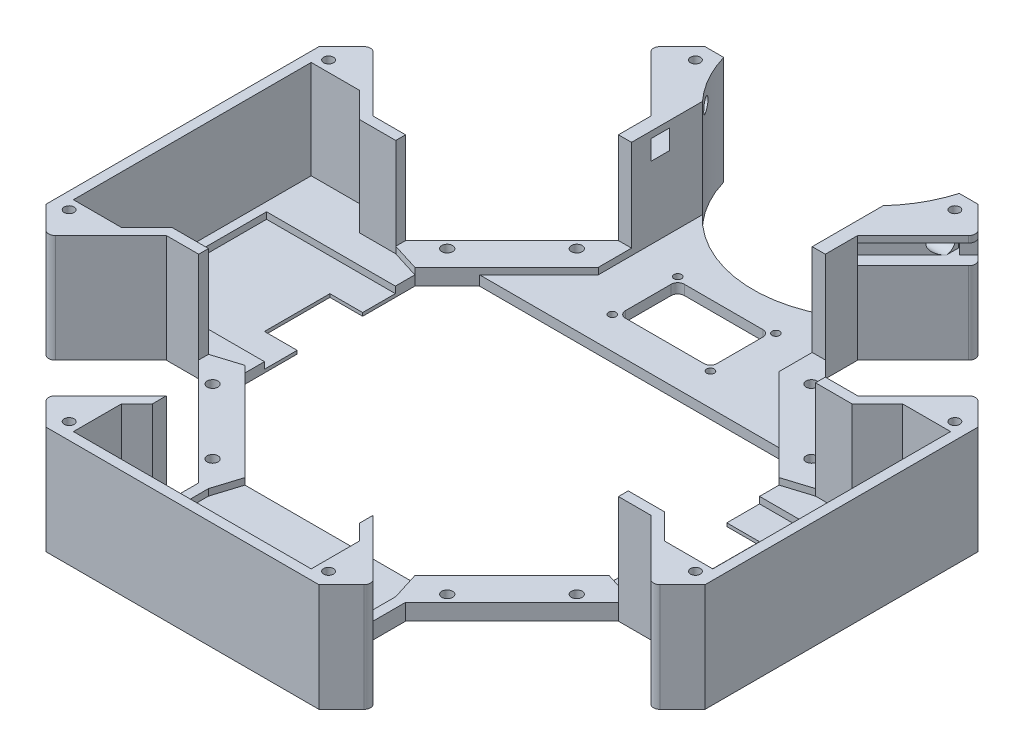
from build123d import *
from build123d.topology import SkipClean

# Parameters (mm, degrees)
BOSS_EXTRUDE1_DEPTH     = 3
CUT_EXTRUDE1_REACH      = 144.447
SKETCH2_R               = 1.65
CUT_EXTRUDE2_REACH      = 144.447
SKETCH3_R               = 37.5
CHAMFER1_SIZE           = 8
CHAMFER2_SIZE           = 7
CUT_EXTRUDE3_REACH      = 144.447
SKETCH4_R               = 1.5
CUT_EXTRUDE4_REACH      = 144.447
BOSS_EXTRUDE2_START     = 30
SKETCH7_R               = 1.5
BOSS_EXTRUDE2_DEPTH     = 30
CUT_EXTRUDE5_REACH      = 148.189
SKETCH8_W               = 20
SKETCH8_H               = 12
SKETCH10_W              = 190
SKETCH10_H              = 40
CUT_EXTRUDE6_DEPTH      = 2
BOSS_EXTRUDE4_START     = 2
SKETCH11_R              = 1.65
BOSS_EXTRUDE4_DEPTH     = 2
SKETCH12_W              = 3
SKETCH12_H              = 14.142135624
CUT_EXTRUDE7_DEPTH      = 28
CUT_EXTRUDE8_REACH      = 148.189
SKETCH13_R              = 1.15
CUT_EXTRUDE9_DEPTH      = 180.62965353
CUT_EXTRUDE9_DEPTH_BACK = 180.62965353
SKETCH14_R              = 2
SKETCH15_R              = 3
CUT_EXTRUDE10_DEPTH     = 10
SKETCH16_W              = 2
SKETCH16_H              = 6
CUT_EXTRUDE11_DEPTH     = 30
CUT_EXTRUDE12_START     = -10
SKETCH17_R              = 3
CUT_EXTRUDE12_DEPTH     = 10
SKETCH18_W              = 2
SKETCH18_H              = 6
CUT_EXTRUDE13_DEPTH     = 30
BOSS_EXTRUDE5_DEPTH     = 33
CUT_EXTRUDE15_REACH     = 247.348
SKETCH22_W              = 4
SKETCH22_H              = 6
CUT_EXTRUDE17_REACH     = 247.348
SKETCH24_W              = 4
SKETCH24_H              = 6
SKETCH25_W              = 131.3026648
SKETCH25_H              = 20
CUT_EXTRUDE18_DEPTH     = 20


with BuildPart() as part:
    # Sketch1 → Boss-Extrude1 (new body)
    with BuildSketch(Plane(origin=(0, 0, 0), x_dir=(1, 0, 0), z_dir=(0, 1, 0))):
        Polygon((-41.712494128, 100.702869044), (-100.702869044, 41.712494128), (-100.702869044, -41.712494128), (-41.712494128, -100.702869044), (41.712494128, -100.702869044), (100.702869044, -41.712494128), (100.702869044, 41.712494128), (41.712494128, 100.702869044), align=None)
    extrude(amount=BOSS_EXTRUDE1_DEPTH)

    # Sketch2 → Cut-Extrude1 (cut, up to next)
    with BuildSketch(Plane(origin=(0, 3, 0), x_dir=(1, 0, 0), z_dir=(0, 1, 0)), mode=Mode.PRIVATE) as cut_extrude1_sk1:
        with Locations(Location((-55.6513324, 35.852342526, 0), (0, 0, 270))):
            Circle(SKETCH2_R)
    cut_extrude1_tool1 = extrude(cut_extrude1_sk1.sketch, amount=-CUT_EXTRUDE1_REACH, mode=Mode.PRIVATE) & part.part
    # Sketch2 → Cut-Extrude1 (cut, up to next)
    with BuildSketch(Plane(origin=(0, 3, 0), x_dir=(1, 0, 0), z_dir=(0, 1, 0)), mode=Mode.PRIVATE) as cut_extrude1_sk2:
        with Locations(Location((-35.852342526, 55.6513324, 0), (0, 0, 270))):
            Circle(SKETCH2_R)
    cut_extrude1_tool2 = extrude(cut_extrude1_sk2.sketch, amount=-CUT_EXTRUDE1_REACH, mode=Mode.PRIVATE) & part.part
    # Sketch2 → Cut-Extrude1 (cut, up to next)
    with BuildSketch(Plane(origin=(0, 3, 0), x_dir=(1, 0, 0), z_dir=(0, 1, 0)), mode=Mode.PRIVATE) as cut_extrude1_sk3:
        with Locations(Location((55.6513324, 35.852342526, 0), (0, 0, 270))):
            Circle(SKETCH2_R)
    cut_extrude1_tool3 = extrude(cut_extrude1_sk3.sketch, amount=-CUT_EXTRUDE1_REACH, mode=Mode.PRIVATE) & part.part
    # Sketch2 → Cut-Extrude1 (cut, up to next)
    with BuildSketch(Plane(origin=(0, 3, 0), x_dir=(1, 0, 0), z_dir=(0, 1, 0)), mode=Mode.PRIVATE) as cut_extrude1_sk4:
        with Locations(Location((35.852342526, 55.6513324, 0), (0, 0, 270))):
            Circle(SKETCH2_R)
    cut_extrude1_tool4 = extrude(cut_extrude1_sk4.sketch, amount=-CUT_EXTRUDE1_REACH, mode=Mode.PRIVATE) & part.part
    # Sketch2 → Cut-Extrude1 (cut, up to next)
    with BuildSketch(Plane(origin=(0, 3, 0), x_dir=(1, 0, 0), z_dir=(0, 1, 0)), mode=Mode.PRIVATE) as cut_extrude1_sk5:
        with Locations(Location((35.852342526, -55.6513324, 0), (0, 0, 270))):
            Circle(SKETCH2_R)
    cut_extrude1_tool5 = extrude(cut_extrude1_sk5.sketch, amount=-CUT_EXTRUDE1_REACH, mode=Mode.PRIVATE) & part.part
    # Sketch2 → Cut-Extrude1 (cut, up to next)
    with BuildSketch(Plane(origin=(0, 3, 0), x_dir=(1, 0, 0), z_dir=(0, 1, 0)), mode=Mode.PRIVATE) as cut_extrude1_sk6:
        with Locations(Location((55.6513324, -35.852342526, 0), (0, 0, 270))):
            Circle(SKETCH2_R)
    cut_extrude1_tool6 = extrude(cut_extrude1_sk6.sketch, amount=-CUT_EXTRUDE1_REACH, mode=Mode.PRIVATE) & part.part
    # Sketch2 → Cut-Extrude1 (cut, up to next)
    with BuildSketch(Plane(origin=(0, 3, 0), x_dir=(1, 0, 0), z_dir=(0, 1, 0)), mode=Mode.PRIVATE) as cut_extrude1_sk7:
        with Locations(Location((-55.6513324, -35.852342526, 0), (0, 0, 270))):
            Circle(SKETCH2_R)
    cut_extrude1_tool7 = extrude(cut_extrude1_sk7.sketch, amount=-CUT_EXTRUDE1_REACH, mode=Mode.PRIVATE) & part.part
    # Sketch2 → Cut-Extrude1 (cut, up to next)
    with BuildSketch(Plane(origin=(0, 3, 0), x_dir=(1, 0, 0), z_dir=(0, 1, 0)), mode=Mode.PRIVATE) as cut_extrude1_sk8:
        with Locations(Location((-35.852342526, -55.6513324, 0), (0, 0, 270))):
            Circle(SKETCH2_R)
    cut_extrude1_tool8 = extrude(cut_extrude1_sk8.sketch, amount=-CUT_EXTRUDE1_REACH, mode=Mode.PRIVATE) & part.part
    # Sketch2 → Cut-Extrude1 (cut, up to next)
    with BuildSketch(Plane(origin=(0, 3, 0), x_dir=(1, 0, 0), z_dir=(0, 1, 0)), mode=Mode.PRIVATE) as cut_extrude1_sk9:
        Polygon((-92.420885021, 49.99447815), (-49.99447815, 92.420885021), (-26.659954371, 69.086361242), (-69.086361242, 26.659954371), align=None)
    cut_extrude1_tool9 = extrude(cut_extrude1_sk9.sketch, amount=-CUT_EXTRUDE1_REACH, mode=Mode.PRIVATE) & part.part
    # Sketch2 → Cut-Extrude1 (cut, up to next)
    with BuildSketch(Plane(origin=(0, 3, 0), x_dir=(1, 0, 0), z_dir=(0, 1, 0)), mode=Mode.PRIVATE) as cut_extrude1_sk10:
        Polygon((49.99447815, 92.420885021), (92.420885021, 49.99447815), (69.086361242, 26.659954371), (26.659954371, 69.086361242), align=None)
    cut_extrude1_tool10 = extrude(cut_extrude1_sk10.sketch, amount=-CUT_EXTRUDE1_REACH, mode=Mode.PRIVATE) & part.part
    # Sketch2 → Cut-Extrude1 (cut, up to next)
    with BuildSketch(Plane(origin=(0, 3, 0), x_dir=(1, 0, 0), z_dir=(0, 1, 0)), mode=Mode.PRIVATE) as cut_extrude1_sk11:
        Polygon((92.420885021, -49.99447815), (49.99447815, -92.420885021), (26.659954371, -69.086361242), (69.086361242, -26.659954371), align=None)
    cut_extrude1_tool11 = extrude(cut_extrude1_sk11.sketch, amount=-CUT_EXTRUDE1_REACH, mode=Mode.PRIVATE) & part.part
    # Sketch2 → Cut-Extrude1 (cut, up to next)
    with BuildSketch(Plane(origin=(0, 3, 0), x_dir=(1, 0, 0), z_dir=(0, 1, 0)), mode=Mode.PRIVATE) as cut_extrude1_sk12:
        Polygon((-49.99447815, -92.420885021), (-92.420885021, -49.99447815), (-69.086361242, -26.659954371), (-26.659954371, -69.086361242), align=None)
    cut_extrude1_tool12 = extrude(cut_extrude1_sk12.sketch, amount=-CUT_EXTRUDE1_REACH, mode=Mode.PRIVATE) & part.part
    add(cut_extrude1_tool1.solids().sort_by_distance((-55.651332, 3, -35.852343))[0], mode=Mode.SUBTRACT)
    add(cut_extrude1_tool2.solids().sort_by_distance((-35.852343, 3, -55.651332))[0], mode=Mode.SUBTRACT)
    add(cut_extrude1_tool3.solids().sort_by_distance((55.651332, 3, -35.852343))[0], mode=Mode.SUBTRACT)
    add(cut_extrude1_tool4.solids().sort_by_distance((35.852343, 3, -55.651332))[0], mode=Mode.SUBTRACT)
    add(cut_extrude1_tool5.solids().sort_by_distance((35.852343, 3, 55.651332))[0], mode=Mode.SUBTRACT)
    add(cut_extrude1_tool6.solids().sort_by_distance((55.651332, 3, 35.852343))[0], mode=Mode.SUBTRACT)
    add(cut_extrude1_tool7.solids().sort_by_distance((-55.651332, 3, 35.852343))[0], mode=Mode.SUBTRACT)
    add(cut_extrude1_tool8.solids().sort_by_distance((-35.852343, 3, 55.651332))[0], mode=Mode.SUBTRACT)
    add(cut_extrude1_tool9.solids().sort_by_distance((-59.54042, 3, -59.54042))[0], mode=Mode.SUBTRACT)
    add(cut_extrude1_tool10.solids().sort_by_distance((59.54042, 3, -59.54042))[0], mode=Mode.SUBTRACT)
    add(cut_extrude1_tool11.solids().sort_by_distance((59.54042, 3, 59.54042))[0], mode=Mode.SUBTRACT)
    add(cut_extrude1_tool12.solids().sort_by_distance((-59.54042, 3, 59.54042))[0], mode=Mode.SUBTRACT)

    # Sketch3 → Cut-Extrude2 (cut, up to next)
    with BuildSketch(Plane(origin=(0, 3, 0), x_dir=(1, 0, 0), z_dir=(0, 1, 0)), mode=Mode.PRIVATE) as cut_extrude2_sk1:
        with Locations((0, 111.202869044)):
            Circle(SKETCH3_R)
    cut_extrude2_tool1 = extrude(cut_extrude2_sk1.sketch, amount=-CUT_EXTRUDE2_REACH, mode=Mode.PRIVATE) & part.part
    add(cut_extrude2_tool1.solids().sort_by_distance((0, 3, -111.202869))[0], mode=Mode.SUBTRACT)

    # Chamfer1
    chamfer1_edges = [part.edges().sort_by_distance(p)[0] for p in [
        (92.420885021, 1.5, 49.99447815),
        (49.99447815, 1.5, 92.420885021),
        (49.99447815, 1.5, -92.420885021),
        (92.420885021, 1.5, -49.99447815),
        (-49.99447815, 1.5, 92.420885021),
        (-92.420885021, 1.5, 49.99447815),
        (-92.420885021, 1.5, -49.99447815),
        (-49.99447815, 1.5, -92.420885021),
    ]]
    chamfer(chamfer1_edges, length=CHAMFER1_SIZE)

    # Chamfer2
    chamfer2_edges = [part.edges().sort_by_distance(p)[0] for p in [
        (69.086361242, 1.5, 26.659954371),
        (26.659954371, 1.5, 69.086361242),
        (26.659954371, 1.5, -69.086361242),
        (69.086361242, 1.5, -26.659954371),
        (-26.659954371, 1.5, 69.086361242),
        (-69.086361242, 1.5, 26.659954371),
        (-69.086361242, 1.5, -26.659954371),
        (-26.659954371, 1.5, -69.086361242),
    ]]
    chamfer(chamfer2_edges, length=CHAMFER2_SIZE)

    # Sketch4 → Cut-Extrude3 (cut, up to next)
    with BuildSketch(Plane(origin=(0, 3, 0), x_dir=(1, 0, 0), z_dir=(0, 1, 0)), mode=Mode.PRIVATE) as cut_extrude3_sk1:
        with Locations(Location((-39.641426316, 95.702869044, 0), (0, 0, 270))):
            Circle(SKETCH4_R)
    cut_extrude3_tool1 = extrude(cut_extrude3_sk1.sketch, amount=-CUT_EXTRUDE3_REACH, mode=Mode.PRIVATE) & part.part
    # Sketch4 → Cut-Extrude3 (cut, up to next)
    with BuildSketch(Plane(origin=(0, 3, 0), x_dir=(1, 0, 0), z_dir=(0, 1, 0)), mode=Mode.PRIVATE) as cut_extrude3_sk2:
        with Locations(Location((39.641426316, 95.702869044, 0), (0, 0, 270))):
            Circle(SKETCH4_R)
    cut_extrude3_tool2 = extrude(cut_extrude3_sk2.sketch, amount=-CUT_EXTRUDE3_REACH, mode=Mode.PRIVATE) & part.part
    # Sketch4 → Cut-Extrude3 (cut, up to next)
    with BuildSketch(Plane(origin=(0, 3, 0), x_dir=(1, 0, 0), z_dir=(0, 1, 0)), mode=Mode.PRIVATE) as cut_extrude3_sk3:
        with Locations(Location((95.702869044, 39.641426316, 0), (0, 0, 270))):
            Circle(SKETCH4_R)
    cut_extrude3_tool3 = extrude(cut_extrude3_sk3.sketch, amount=-CUT_EXTRUDE3_REACH, mode=Mode.PRIVATE) & part.part
    # Sketch4 → Cut-Extrude3 (cut, up to next)
    with BuildSketch(Plane(origin=(0, 3, 0), x_dir=(1, 0, 0), z_dir=(0, 1, 0)), mode=Mode.PRIVATE) as cut_extrude3_sk4:
        with Locations(Location((95.702869044, -39.641426316, 0), (0, 0, 270))):
            Circle(SKETCH4_R)
    cut_extrude3_tool4 = extrude(cut_extrude3_sk4.sketch, amount=-CUT_EXTRUDE3_REACH, mode=Mode.PRIVATE) & part.part
    # Sketch4 → Cut-Extrude3 (cut, up to next)
    with BuildSketch(Plane(origin=(0, 3, 0), x_dir=(1, 0, 0), z_dir=(0, 1, 0)), mode=Mode.PRIVATE) as cut_extrude3_sk5:
        with Locations(Location((39.641426316, -95.702869044, 0), (0, 0, 270))):
            Circle(SKETCH4_R)
    cut_extrude3_tool5 = extrude(cut_extrude3_sk5.sketch, amount=-CUT_EXTRUDE3_REACH, mode=Mode.PRIVATE) & part.part
    # Sketch4 → Cut-Extrude3 (cut, up to next)
    with BuildSketch(Plane(origin=(0, 3, 0), x_dir=(1, 0, 0), z_dir=(0, 1, 0)), mode=Mode.PRIVATE) as cut_extrude3_sk6:
        with Locations(Location((-39.641426316, -95.702869044, 0), (0, 0, 270))):
            Circle(SKETCH4_R)
    cut_extrude3_tool6 = extrude(cut_extrude3_sk6.sketch, amount=-CUT_EXTRUDE3_REACH, mode=Mode.PRIVATE) & part.part
    # Sketch4 → Cut-Extrude3 (cut, up to next)
    with BuildSketch(Plane(origin=(0, 3, 0), x_dir=(1, 0, 0), z_dir=(0, 1, 0)), mode=Mode.PRIVATE) as cut_extrude3_sk7:
        with Locations(Location((-95.702869044, -39.641426316, 0), (0, 0, 270))):
            Circle(SKETCH4_R)
    cut_extrude3_tool7 = extrude(cut_extrude3_sk7.sketch, amount=-CUT_EXTRUDE3_REACH, mode=Mode.PRIVATE) & part.part
    # Sketch4 → Cut-Extrude3 (cut, up to next)
    with BuildSketch(Plane(origin=(0, 3, 0), x_dir=(1, 0, 0), z_dir=(0, 1, 0)), mode=Mode.PRIVATE) as cut_extrude3_sk8:
        with Locations(Location((-95.702869044, 39.641426316, 0), (0, 0, 270))):
            Circle(SKETCH4_R)
    cut_extrude3_tool8 = extrude(cut_extrude3_sk8.sketch, amount=-CUT_EXTRUDE3_REACH, mode=Mode.PRIVATE) & part.part
    add(cut_extrude3_tool1.solids().sort_by_distance((-39.641426, 3, -95.702869))[0], mode=Mode.SUBTRACT)
    add(cut_extrude3_tool2.solids().sort_by_distance((39.641426, 3, -95.702869))[0], mode=Mode.SUBTRACT)
    add(cut_extrude3_tool3.solids().sort_by_distance((95.702869, 3, -39.641426))[0], mode=Mode.SUBTRACT)
    add(cut_extrude3_tool4.solids().sort_by_distance((95.702869, 3, 39.641426))[0], mode=Mode.SUBTRACT)
    add(cut_extrude3_tool5.solids().sort_by_distance((39.641426, 3, 95.702869))[0], mode=Mode.SUBTRACT)
    add(cut_extrude3_tool6.solids().sort_by_distance((-39.641426, 3, 95.702869))[0], mode=Mode.SUBTRACT)
    add(cut_extrude3_tool7.solids().sort_by_distance((-95.702869, 3, 39.641426))[0], mode=Mode.SUBTRACT)
    add(cut_extrude3_tool8.solids().sort_by_distance((-95.702869, 3, -39.641426))[0], mode=Mode.SUBTRACT)

    # Sketch5 → Cut-Extrude4 (cut, up to next)
    with BuildSketch(Plane(origin=(0, 3, 0), x_dir=(1, 0, 0), z_dir=(0, 1, 0)), mode=Mode.PRIVATE) as cut_extrude4_sk1:
        Polygon((-45.751837463, 35.852342526), (-55.6513324, 25.95284759), (-55.6513324, -25.95284759), (-25.95284759, -55.6513324), (25.95284759, -55.6513324), (55.6513324, -25.95284759), (55.6513324, 25.95284759), (45.751837463, 35.852342526), align=None)
    cut_extrude4_tool1 = extrude(cut_extrude4_sk1.sketch, amount=-CUT_EXTRUDE4_REACH, mode=Mode.PRIVATE) & part.part
    add(cut_extrude4_tool1.solids().sort_by_distance((0, 3, 6.916045))[0], mode=Mode.SUBTRACT)

    # Sketch7 → Boss-Extrude2 (add)
    # profile 1 of 5: a face of its own
    with SkipClean():  # the faces are left unmerged after this step: merging them gives an invalid solid
        with BuildSketch(Plane(origin=(0, 3, 0), x_dir=(1, 0, 0), z_dir=(0, 1, 0)).offset(BOSS_EXTRUDE2_START)):
            Polygon((-64.136613774, 31.609701839), (-74.036108711, 31.609701839), (-86.764030772, 44.337623901), (-98.077739271, 44.337623901), (-100.702869044, 41.712494128), (-100.702869044, -41.712494128), (-98.077739271, -44.337623901), (-86.764030772, -44.337623901), (-74.036108711, -31.609701839), (-64.136613774, -31.609701839), (-64.136613774, -28.609701839), (-75.278749398, -28.609701839), (-83.006671459, -36.337623901), (-97.702869044, -36.337623901), (-97.702869044, 36.337623901), (-83.006671459, 36.337623901), (-75.278749398, 28.609701839), (-64.136613774, 28.609701839), align=None)
            with Locations(Location((-95.702869044, -39.641426316, 0), (0, 0, 270))):
                Circle(SKETCH7_R, mode=Mode.SUBTRACT)
            with Locations(Location((-95.702869044, 39.641426316, 0), (0, 0, 270))):
                Circle(SKETCH7_R, mode=Mode.SUBTRACT)
        # profile 2 of 5: a face of its own
        with BuildSketch(Plane(origin=(0, 3, 0), x_dir=(1, 0, 0), z_dir=(0, 1, 0)).offset(BOSS_EXTRUDE2_START)):
            Polygon((-31.609701839, -64.136613774), (-31.609701839, -74.036108711), (-44.337623901, -86.764030772), (-44.337623901, -98.077739271), (-41.712494128, -100.702869044), (41.712494128, -100.702869044), (44.337623901, -98.077739271), (44.337623901, -86.764030772), (31.609701839, -74.036108711), (31.609701839, -64.136613774), (28.609701839, -64.136613774), (28.609701839, -75.278749398), (36.337623901, -83.006671459), (36.337623901, -97.702869044), (-36.337623901, -97.702869044), (-36.337623901, -83.006671459), (-28.609701839, -75.278749398), (-28.609701839, -64.136613774), align=None)
            with Locations(Location((39.641426316, -95.702869044, 0), (0, 0, 270))):
                Circle(SKETCH7_R, mode=Mode.SUBTRACT)
            with Locations(Location((-39.641426316, -95.702869044, 0), (0, 0, 270))):
                Circle(SKETCH7_R, mode=Mode.SUBTRACT)
        # profile 3 of 5: a face of its own
        with BuildSketch(Plane(origin=(0, 3, 0), x_dir=(1, 0, 0), z_dir=(0, 1, 0)).offset(BOSS_EXTRUDE2_START)):
            Polygon((64.136613774, -31.609701839), (74.036108711, -31.609701839), (86.764030772, -44.337623901), (98.077739271, -44.337623901), (100.702869044, -41.712494128), (100.702869044, 41.712494128), (98.077739271, 44.337623901), (86.764030772, 44.337623901), (74.036108711, 31.609701839), (64.136613774, 31.609701839), (64.136613774, 28.609701839), (75.278749398, 28.609701839), (83.006671459, 36.337623901), (97.702869044, 36.337623901), (97.702869044, -36.337623901), (83.006671459, -36.337623901), (75.278749398, -28.609701839), (64.136613774, -28.609701839), align=None)
            with Locations(Location((95.702869044, 39.641426316, 0), (0, 0, 270))):
                Circle(SKETCH7_R, mode=Mode.SUBTRACT)
            with Locations(Location((95.702869044, -39.641426316, 0), (0, 0, 270))):
                Circle(SKETCH7_R, mode=Mode.SUBTRACT)
        # profile 4 of 5: a face of its own
        with BuildSketch(Plane(origin=(0, 3, 0), x_dir=(1, 0, 0), z_dir=(0, 1, 0)).offset(BOSS_EXTRUDE2_START)):
            with BuildLine():
                Line((-36, 100.702869044), (-41.712494128, 100.702869044))
                Line((-41.712494128, 100.702869044), (-44.337623901, 98.077739271))
                Line((-44.337623901, 98.077739271), (-44.337623901, 86.764030772))
                Line((-44.337623901, 86.764030772), (-31.609701839, 74.036108711))
                Line((-31.609701839, 74.036108711), (-31.609701839, 64.136613774))
                Line((-31.609701839, 64.136613774), (-27.609701839, 64.136613774))
                Line((-27.609701839, 64.136613774), (-27.609701839, 85.826613127))
                ThreePointArc((-27.609701839, 85.826613127), (-32.663041646, 92.780716334), (-36, 100.702869044))
            make_face()
            with Locations(Location((-39.641426316, 95.702869044, 0), (0, 0, 270))):
                Circle(SKETCH7_R, mode=Mode.SUBTRACT)
        # profile 5 of 5: a face of its own
        with BuildSketch(Plane(origin=(0, 3, 0), x_dir=(1, 0, 0), z_dir=(0, 1, 0)).offset(BOSS_EXTRUDE2_START)):
            with BuildLine():
                Line((27.609701839, 64.136613774), (27.609701839, 85.826613127))
                ThreePointArc((27.609701839, 85.826613127), (32.663041646, 92.780716334), (36, 100.702869044))
                Line((36, 100.702869044), (41.712494128, 100.702869044))
                Line((41.712494128, 100.702869044), (44.337623901, 98.077739271))
                Line((44.337623901, 98.077739271), (44.337623901, 86.764030772))
                Line((44.337623901, 86.764030772), (31.609701839, 74.036108711))
                Line((31.609701839, 74.036108711), (31.609701839, 64.136613774))
                Line((31.609701839, 64.136613774), (27.609701839, 64.136613774))
            make_face()
            with Locations(Location((39.641426316, 95.702869044, 0), (0, 0, 270))):
                Circle(SKETCH7_R, mode=Mode.SUBTRACT)
        extrude(amount=-BOSS_EXTRUDE2_DEPTH)

    # Sketch8 → Cut-Extrude5 (cut, up to next)
    with BuildSketch(Plane.XZ, mode=Mode.PRIVATE) as cut_extrude5_sk1:
        with Locations((-12, 89.702869044)):
            Rectangle(SKETCH8_W, SKETCH8_H)
    cut_extrude5_tool1 = extrude(cut_extrude5_sk1.sketch, amount=-CUT_EXTRUDE5_REACH, mode=Mode.PRIVATE) & part.part
    # Sketch8 → Cut-Extrude5 (cut, up to next)
    with BuildSketch(Plane.XZ, mode=Mode.PRIVATE) as cut_extrude5_sk2:
        with Locations((12, 89.702869044)):
            Rectangle(SKETCH8_W, SKETCH8_H)
    cut_extrude5_tool2 = extrude(cut_extrude5_sk2.sketch, amount=-CUT_EXTRUDE5_REACH, mode=Mode.PRIVATE) & part.part
    add(cut_extrude5_tool1.solids().sort_by_distance((-12, 0, 89.702869))[0], mode=Mode.SUBTRACT)
    add(cut_extrude5_tool2.solids().sort_by_distance((12, 0, 89.702869))[0], mode=Mode.SUBTRACT)

    # Sketch10 → Cut-Extrude6 (cut)
    with SkipClean():  # the faces are left unmerged after this step: merging them gives an invalid solid
        with BuildSketch(Plane(origin=(0, 3, 0), x_dir=(1, 0, 0), z_dir=(0, 1, 0))):
            Rectangle(SKETCH10_W, SKETCH10_H)
        extrude(amount=-CUT_EXTRUDE6_DEPTH, mode=Mode.SUBTRACT)

    # Sketch11 → Boss-Extrude4 (add)
    # profile 1 of 4: a face of its own
    with SkipClean():  # the faces are left unmerged after this step: merging them gives an invalid solid
        with BuildSketch(Plane(origin=(0, 3, 0), x_dir=(1, 0, 0), z_dir=(0, 1, 0)).offset(BOSS_EXTRUDE4_START)):
            Polygon((-31.609701839, 64.136613774), (-64.136613774, 31.609701839), (-64.136613774, 28.609701839), (-55.6513324, 25.95284759), (-27.609701839, 53.99447815), (-27.609701839, 64.136613774), align=None)
            with Locations(Location((-35.852342526, 55.6513324, 0), (0, 0, 270))):
                Circle(SKETCH11_R, mode=Mode.SUBTRACT)
            with Locations(Location((-55.6513324, 35.852342526, 0), (0, 0, 270))):
                Circle(SKETCH11_R, mode=Mode.SUBTRACT)
        # profile 2 of 4: a face of its own
        with BuildSketch(Plane(origin=(0, 3, 0), x_dir=(1, 0, 0), z_dir=(0, 1, 0)).offset(BOSS_EXTRUDE4_START)):
            Polygon((-28.609701839, -64.136613774), (-25.95284759, -55.6513324), (-55.6513324, -25.95284759), (-64.136613774, -28.609701839), (-64.136613774, -31.609701839), (-31.609701839, -64.136613774), align=None)
            with Locations(Location((-55.6513324, -35.852342526, 0), (0, 0, 270))):
                Circle(SKETCH11_R, mode=Mode.SUBTRACT)
            with Locations(Location((-35.852342526, -55.6513324, 0), (0, 0, 270))):
                Circle(SKETCH11_R, mode=Mode.SUBTRACT)
        # profile 3 of 4: a face of its own
        with BuildSketch(Plane(origin=(0, 3, 0), x_dir=(1, 0, 0), z_dir=(0, 1, 0)).offset(BOSS_EXTRUDE4_START)):
            Polygon((31.609701839, -64.136613774), (28.609701839, -64.136613774), (25.95284759, -55.6513324), (55.6513324, -25.95284759), (64.136613774, -28.609701839), (64.136613774, -31.609701839), align=None)
            with Locations(Location((35.852342526, -55.6513324, 0), (0, 0, 270))):
                Circle(SKETCH11_R, mode=Mode.SUBTRACT)
            with Locations(Location((55.6513324, -35.852342526, 0), (0, 0, 270))):
                Circle(SKETCH11_R, mode=Mode.SUBTRACT)
        # profile 4 of 4: a face of its own
        with BuildSketch(Plane(origin=(0, 3, 0), x_dir=(1, 0, 0), z_dir=(0, 1, 0)).offset(BOSS_EXTRUDE4_START)):
            Polygon((27.609701839, 64.136613774), (31.609701839, 64.136613774), (64.136613774, 31.609701839), (64.136613774, 28.609701839), (55.6513324, 25.95284759), (27.609701839, 53.99447815), align=None)
            with Locations(Location((55.6513324, 35.852342526, 0), (0, 0, 270))):
                Circle(SKETCH11_R, mode=Mode.SUBTRACT)
            with Locations(Location((35.852342526, 55.6513324, 0), (0, 0, 270))):
                Circle(SKETCH11_R, mode=Mode.SUBTRACT)
        extrude(amount=-BOSS_EXTRUDE4_DEPTH)

    # Sketch12 → Cut-Extrude7 (cut)
    with SkipClean():  # the faces are left unmerged after this step: merging them gives an invalid solid
        with BuildSketch(Plane(origin=(0, 33, 0), x_dir=(1, 0, 0), z_dir=(0, 1, 0))):
            with Locations((-30.109701839, -71.207681586)):
                Rectangle(SKETCH12_W, SKETCH12_H)
            with Locations((30.109701839, -71.207681586)):
                Rectangle(SKETCH12_W, SKETCH12_H)
        extrude(amount=-CUT_EXTRUDE7_DEPTH, mode=Mode.SUBTRACT)

    # Sketch13 → Cut-Extrude8 (cut, up to next)
    with BuildSketch(Plane(origin=(0, 0, 0), x_dir=(-1, 0, 0), z_dir=(0, -1, 0)), mode=Mode.PRIVATE) as cut_extrude8_sk1:
        with Locations(Location((15, 45.6513324, 0), (0, 0, 90))):
            Circle(SKETCH13_R)
    cut_extrude8_tool1 = extrude(cut_extrude8_sk1.sketch, amount=-CUT_EXTRUDE8_REACH, mode=Mode.PRIVATE) & part.part
    # Sketch13 → Cut-Extrude8 (cut, up to next)
    with BuildSketch(Plane(origin=(0, 0, 0), x_dir=(-1, 0, 0), z_dir=(0, -1, 0)), mode=Mode.PRIVATE) as cut_extrude8_sk2:
        with Locations(Location((-15, 45.6513324, 0), (0, 0, 90))):
            Circle(SKETCH13_R)
    cut_extrude8_tool2 = extrude(cut_extrude8_sk2.sketch, amount=-CUT_EXTRUDE8_REACH, mode=Mode.PRIVATE) & part.part
    # Sketch13 → Cut-Extrude8 (cut, up to next)
    with BuildSketch(Plane(origin=(0, 0, 0), x_dir=(-1, 0, 0), z_dir=(0, -1, 0)), mode=Mode.PRIVATE) as cut_extrude8_sk3:
        with Locations(Location((15, 65.6513324, 0), (0, 0, 90))):
            Circle(SKETCH13_R)
    cut_extrude8_tool3 = extrude(cut_extrude8_sk3.sketch, amount=-CUT_EXTRUDE8_REACH, mode=Mode.PRIVATE) & part.part
    # Sketch13 → Cut-Extrude8 (cut, up to next)
    with BuildSketch(Plane(origin=(0, 0, 0), x_dir=(-1, 0, 0), z_dir=(0, -1, 0)), mode=Mode.PRIVATE) as cut_extrude8_sk4:
        with Locations(Location((-15, 65.6513324, 0), (0, 0, 90))):
            Circle(SKETCH13_R)
    cut_extrude8_tool4 = extrude(cut_extrude8_sk4.sketch, amount=-CUT_EXTRUDE8_REACH, mode=Mode.PRIVATE) & part.part
    # Sketch13 → Cut-Extrude8 (cut, up to next)
    with BuildSketch(Plane(origin=(0, 0, 0), x_dir=(-1, 0, 0), z_dir=(0, -1, 0)), mode=Mode.PRIVATE) as cut_extrude8_sk5:
        with BuildLine():
            Line((12, 64.6513324), (-12, 64.6513324))
            ThreePointArc((-12, 64.6513324), (-13.414213562, 64.065545962), (-14, 62.6513324))
            Line((-14, 62.6513324), (-14, 48.6513324))
            ThreePointArc((-14, 48.6513324), (-13.414213562, 47.237118837), (-12, 46.6513324))
            Line((-12, 46.6513324), (12, 46.6513324))
            ThreePointArc((12, 46.6513324), (13.414213562, 47.237118837), (14, 48.6513324))
            Line((14, 48.6513324), (14, 62.6513324))
            ThreePointArc((14, 62.6513324), (13.414213562, 64.065545962), (12, 64.6513324))
        make_face()
    cut_extrude8_tool5 = extrude(cut_extrude8_sk5.sketch, amount=-CUT_EXTRUDE8_REACH, mode=Mode.PRIVATE) & part.part
    add(cut_extrude8_tool1.solids().sort_by_distance((-15, 0, -45.651332))[0], mode=Mode.SUBTRACT)
    add(cut_extrude8_tool2.solids().sort_by_distance((15, 0, -45.651332))[0], mode=Mode.SUBTRACT)
    add(cut_extrude8_tool3.solids().sort_by_distance((-15, 0, -65.651332))[0], mode=Mode.SUBTRACT)
    add(cut_extrude8_tool4.solids().sort_by_distance((15, 0, -65.651332))[0], mode=Mode.SUBTRACT)
    add(cut_extrude8_tool5.solids().sort_by_distance((0, 0, -55.651332))[0], mode=Mode.SUBTRACT)

    # Sketch14 → Cut-Extrude9 (cut, two sides: drawn at the far end of the back side and taken through both)
    with SkipClean():  # the faces are left unmerged after this step: merging them gives an invalid solid
        with BuildSketch(Plane.ZY.offset(44.337623901).offset(-CUT_EXTRUDE9_DEPTH_BACK)):
            with Locations((-90.264030772, 28)):
                Circle(SKETCH14_R)
        extrude(amount=CUT_EXTRUDE9_DEPTH + CUT_EXTRUDE9_DEPTH_BACK, mode=Mode.SUBTRACT)

    # Sketch15 → Cut-Extrude10 (cut)
    with SkipClean():  # the faces are left unmerged after this step: merging them gives an invalid solid
        with BuildSketch(Plane.ZY.offset(44.337623901)):
            with Locations((-90.264030772, 28)):
                Circle(SKETCH15_R)
        extrude(amount=-CUT_EXTRUDE10_DEPTH, mode=Mode.SUBTRACT)

    # Sketch16 → Cut-Extrude11 (cut)
    with SkipClean():  # the faces are left unmerged after this step: merging them gives an invalid solid
        with BuildSketch(Plane.XY.offset(-64.136613774)):
            with Locations((-43.337623901, 28)):
                Rectangle(SKETCH16_W, SKETCH16_H)
        extrude(amount=-CUT_EXTRUDE11_DEPTH, mode=Mode.SUBTRACT)

    # Sketch17 → Cut-Extrude12 (cut)
    with SkipClean():  # the faces are left unmerged after this step: merging them gives an invalid solid
        with BuildSketch(Plane(origin=(44.337623901, 0, 0), x_dir=(0, 0, -1), z_dir=(1, 0, 0)).offset(CUT_EXTRUDE12_START)):
            with Locations(Location((90.264030772, 28, 0), (0, 0, 180))):
                Circle(SKETCH17_R)
        extrude(amount=CUT_EXTRUDE12_DEPTH, mode=Mode.SUBTRACT)

    # Sketch18 → Cut-Extrude13 (cut)
    with SkipClean():  # the faces are left unmerged after this step: merging them gives an invalid solid
        with BuildSketch(Plane.XY.offset(-64.136613774)):
            with Locations((43.337623901, 28)):
                Rectangle(SKETCH18_W, SKETCH18_H)
        extrude(amount=-CUT_EXTRUDE13_DEPTH, mode=Mode.SUBTRACT)

    # Sketch21 → Boss-Extrude5 (add)
    with SkipClean():  # the faces are left unmerged after this step: merging them gives an invalid solid
        with BuildSketch(Plane(origin=(0, 0, 0), x_dir=(1, 0, 0), z_dir=(0, 1, 0))):
            with BuildLine():
                Line((-98.077739271, 44.337623901), (-93.835098584, 48.580264588))
                ThreePointArc((-93.835098584, 48.580264588), (-92.420885021, 49.166051025), (-91.006671459, 48.580264588))
                Line((-91.006671459, 48.580264588), (-86.764030772, 44.337623901))
                Line((-86.764030772, 44.337623901), (-98.077739271, 44.337623901))
            make_face()
            with BuildLine():
                Line((-44.337623901, 86.764030772), (-48.580264588, 91.006671459))
                ThreePointArc((-48.580264588, 91.006671459), (-49.166051025, 92.420885021), (-48.580264588, 93.835098584))
                Line((-48.580264588, 93.835098584), (-44.337623901, 98.077739271))
                Line((-44.337623901, 98.077739271), (-44.337623901, 86.764030772))
            make_face()
            with BuildLine():
                Line((44.337623901, 86.764030772), (48.580264588, 91.006671459))
                ThreePointArc((48.580264588, 91.006671459), (49.166051025, 92.420885021), (48.580264588, 93.835098584))
                Line((48.580264588, 93.835098584), (44.337623901, 98.077739271))
                Line((44.337623901, 98.077739271), (44.337623901, 86.764030772))
            make_face()
            with BuildLine():
                Line((86.764030772, 44.337623901), (91.006671459, 48.580264588))
                ThreePointArc((91.006671459, 48.580264588), (92.420885021, 49.166051025), (93.835098584, 48.580264588))
                Line((93.835098584, 48.580264588), (98.077739271, 44.337623901))
                Line((98.077739271, 44.337623901), (86.764030772, 44.337623901))
            make_face()
            with BuildLine():
                Line((86.764030772, -44.337623901), (91.006671459, -48.580264588))
                ThreePointArc((91.006671459, -48.580264588), (92.420885021, -49.166051025), (93.835098584, -48.580264588))
                Line((93.835098584, -48.580264588), (98.077739271, -44.337623901))
                Line((98.077739271, -44.337623901), (86.764030772, -44.337623901))
            make_face()
            with BuildLine():
                Line((44.337623901, -86.764030772), (48.580264588, -91.006671459))
                ThreePointArc((48.580264588, -91.006671459), (49.166051025, -92.420885021), (48.580264588, -93.835098584))
                Line((48.580264588, -93.835098584), (44.337623901, -98.077739271))
                Line((44.337623901, -98.077739271), (44.337623901, -86.764030772))
            make_face()
            with BuildLine():
                Line((-44.337623901, -98.077739271), (-48.580264588, -93.835098584))
                ThreePointArc((-48.580264588, -93.835098584), (-49.166051025, -92.420885021), (-48.580264588, -91.006671459))
                Line((-48.580264588, -91.006671459), (-44.337623901, -86.764030772))
                Line((-44.337623901, -86.764030772), (-44.337623901, -98.077739271))
            make_face()
            with BuildLine():
                Line((-98.077739271, -44.337623901), (-93.835098584, -48.580264588))
                ThreePointArc((-93.835098584, -48.580264588), (-92.420885021, -49.166051025), (-91.006671459, -48.580264588))
                Line((-91.006671459, -48.580264588), (-86.764030772, -44.337623901))
                Line((-86.764030772, -44.337623901), (-98.077739271, -44.337623901))
            make_face()
        extrude(amount=BOSS_EXTRUDE5_DEPTH)

    # Cut-Extrude15: up to this plane
    with SkipClean():  # the faces are left unmerged after this step: merging them gives an invalid solid
        cut_extrude15_end = Plane(origin=(27.609701839, 33, -64.136613774), z_dir=(1, 0, 0))
        # Sketch22 → Cut-Extrude15 (cut, up to the surface)
        with BuildSketch(Plane(origin=(71.207681586, 0, -71.207681586), x_dir=(-0.7071067811865476, 0, -0.7071067811865476), z_dir=(0.7071067811865476, 0, -0.7071067811865476)), mode=Mode.PRIVATE) as cut_extrude15_sk1:
            with Locations((32, 28)):
                Rectangle(SKETCH22_W, SKETCH22_H)
        cut_extrude15_tool1 = split(extrude(cut_extrude15_sk1.sketch, amount=-CUT_EXTRUDE15_REACH, mode=Mode.PRIVATE), bisect_by=cut_extrude15_end, keep=Keep.BOTH, mode=Mode.PRIVATE)
        add(cut_extrude15_tool1.solids().sort_by_distance((48.580265, 28, -93.835099))[0], mode=Mode.SUBTRACT)

    # Cut-Extrude17: up to this plane
    with SkipClean():  # the faces are left unmerged after this step: merging them gives an invalid solid
        cut_extrude17_end = Plane(origin=(-27.609701839, 33, -64.136613774), z_dir=(-1, 0, 0))
        # Sketch24 → Cut-Extrude17 (cut, up to the surface)
        with BuildSketch(Plane(origin=(-71.207681586, 0, -71.207681586), x_dir=(-0.7071067811865475, 0, 0.7071067811865477), z_dir=(-0.7071067811865477, 0, -0.7071067811865475)), mode=Mode.PRIVATE) as cut_extrude17_sk1:
            with Locations((-32, 28)):
                Rectangle(SKETCH24_W, SKETCH24_H)
        cut_extrude17_tool1 = split(extrude(cut_extrude17_sk1.sketch, amount=-CUT_EXTRUDE17_REACH, mode=Mode.PRIVATE), bisect_by=cut_extrude17_end, keep=Keep.BOTH, mode=Mode.PRIVATE)
        add(cut_extrude17_tool1.solids().sort_by_distance((-48.580265, 28, -93.835099))[0], mode=Mode.SUBTRACT)

    # Sketch25 → Cut-Extrude18 (cut)
    with SkipClean():  # the faces are left unmerged after this step: merging them gives an invalid solid
        with BuildSketch(Plane(origin=(0, 1, 0), x_dir=(1, 0, 0), z_dir=(0, 1, 0))):
            Rectangle(SKETCH25_W, SKETCH25_H)
        extrude(amount=-CUT_EXTRUDE18_DEPTH, mode=Mode.SUBTRACT)


solid = part.part
